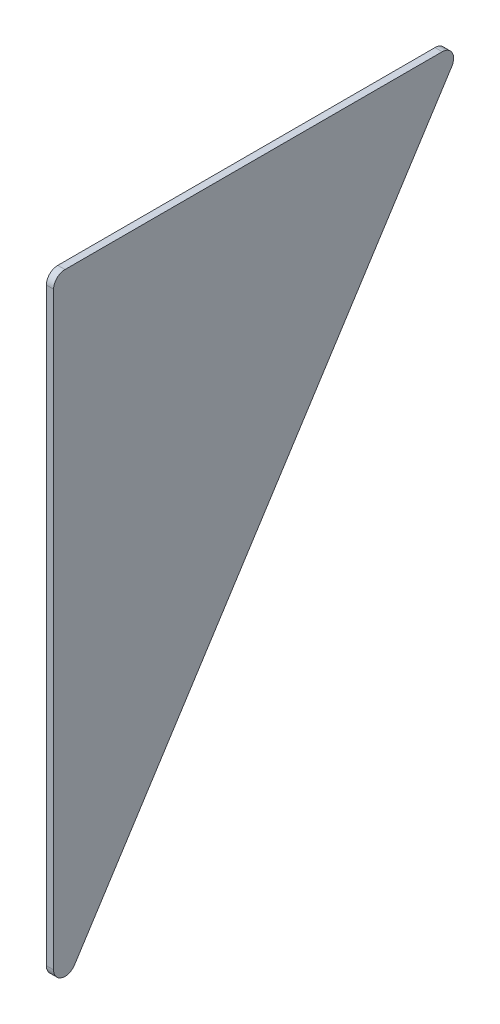
from build123d import *

# Parameters (mm, degrees)
BOSS_EXTRUDE1_DEPTH = 3.175


with BuildPart() as part:
    # Sketch1 → Boss-Extrude1 (new body)
    with BuildSketch(Plane(origin=(0, 0, 0), x_dir=(0, 0, -1), z_dir=(1, 0, 0))):
        with BuildLine():
            Line((5, 0), (170.863496051, 0))
            ThreePointArc((170.863496051, 0), (175.249649397, -2.599654436), (175.074809542, -7.695336469))
            Line((175.074809542, -7.695336469), (9.211313491, -266.84783441))
            ThreePointArc((9.211313491, -266.84783441), (3.595821852, -268.951277341), (0, -264.152497941))
            Line((0, -264.152497941), (0, -5))
            ThreePointArc((0, -5), (1.464466094, -1.464466094), (5, 0))
        make_face()
    extrude(amount=BOSS_EXTRUDE1_DEPTH)


solid = part.part
